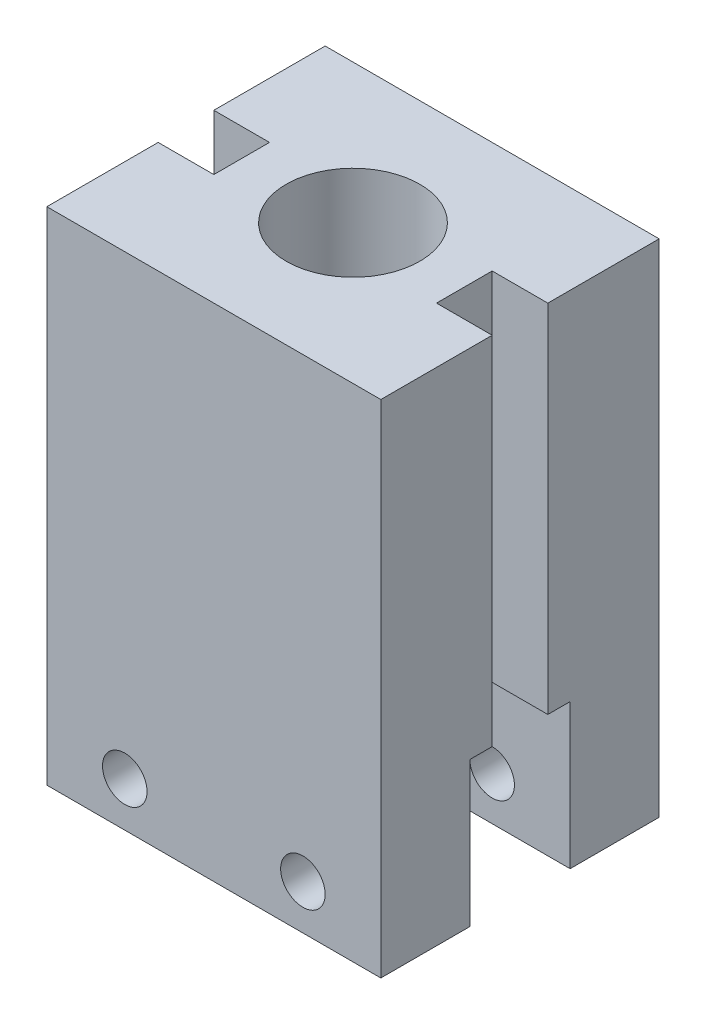
from build123d import *

# Parameters (mm, degrees)
SKETCH1_W           = 30
SKETCH1_H           = 25
BOSS_EXTRUDE1_DEPTH = 45
SKETCH2_W           = 5
SKETCH2_H           = 5
CUT_EXTRUDE1_DEPTH  = 45
SKETCH4_R           = 2
CUT_EXTRUDE17_DEPTH = 9
SKETCH5_W           = 9
SKETCH5_H           = 13
CUT_EXTRUDE18_DEPTH = 56.509008278
CUT_EXTRUDE19_START = -9
SKETCH6_R           = 2
CUT_EXTRUDE19_DEPTH = 9
SKETCH7_R           = 6
CUT_EXTRUDE20_DEPTH = 50.053542176


with BuildPart() as part:
    # Sketch1 → Boss-Extrude1 (new body)
    with BuildSketch(Plane(origin=(0, 0, 0), x_dir=(1, 0, 0), z_dir=(0, 1, 0))):
        Rectangle(SKETCH1_W, SKETCH1_H)
    extrude(amount=BOSS_EXTRUDE1_DEPTH)

    # Sketch2 → Cut-Extrude1 (cut)
    with BuildSketch(Plane(origin=(0, 45, 0), x_dir=(1, 0, 0), z_dir=(0, 1, 0))):
        with Locations((12.5, 0)):
            Rectangle(SKETCH2_W, SKETCH2_H)
        with Locations((-12.5, 0)):
            Rectangle(SKETCH2_W, SKETCH2_H)
    extrude(amount=-CUT_EXTRUDE1_DEPTH, mode=Mode.SUBTRACT)

    # Sketch4 → Cut-Extrude17 (cut)
    with BuildSketch(Plane(origin=(0, 0, -12.5), x_dir=(-1, 0, 0), z_dir=(0, 0, -1))):
        with Locations((8, 4)):
            Circle(SKETCH4_R)
        with Locations((-8, 4)):
            Circle(SKETCH4_R)
    extrude(amount=-CUT_EXTRUDE17_DEPTH, mode=Mode.SUBTRACT)

    # Sketch5 → Cut-Extrude18 (cut, through all)
    with BuildSketch(Plane.ZY.offset(15)):
        with Locations((0, 6.5)):
            Rectangle(SKETCH5_W, SKETCH5_H)
    extrude(amount=-CUT_EXTRUDE18_DEPTH, mode=Mode.SUBTRACT)

    # Sketch6 → Cut-Extrude19 (cut)
    with BuildSketch(Plane.XY.offset(12.5).offset(CUT_EXTRUDE19_START)):
        with Locations(Location((8, 4, 0), (0, 0, 180))):
            Circle(SKETCH6_R)
        with Locations(Location((-8, 4, 0), (0, 0, 180))):
            Circle(SKETCH6_R)
    extrude(amount=CUT_EXTRUDE19_DEPTH, mode=Mode.SUBTRACT)

    # Sketch7 → Cut-Extrude20 (cut, through all)
    with BuildSketch(Plane(origin=(0, 45, 0), x_dir=(1, 0, 0), z_dir=(0, 1, 0))):
        with Locations(Location((0, 0, 0), (0, 0, 270))):
            Circle(SKETCH7_R)
    extrude(amount=-CUT_EXTRUDE20_DEPTH, mode=Mode.SUBTRACT)


solid = part.part
